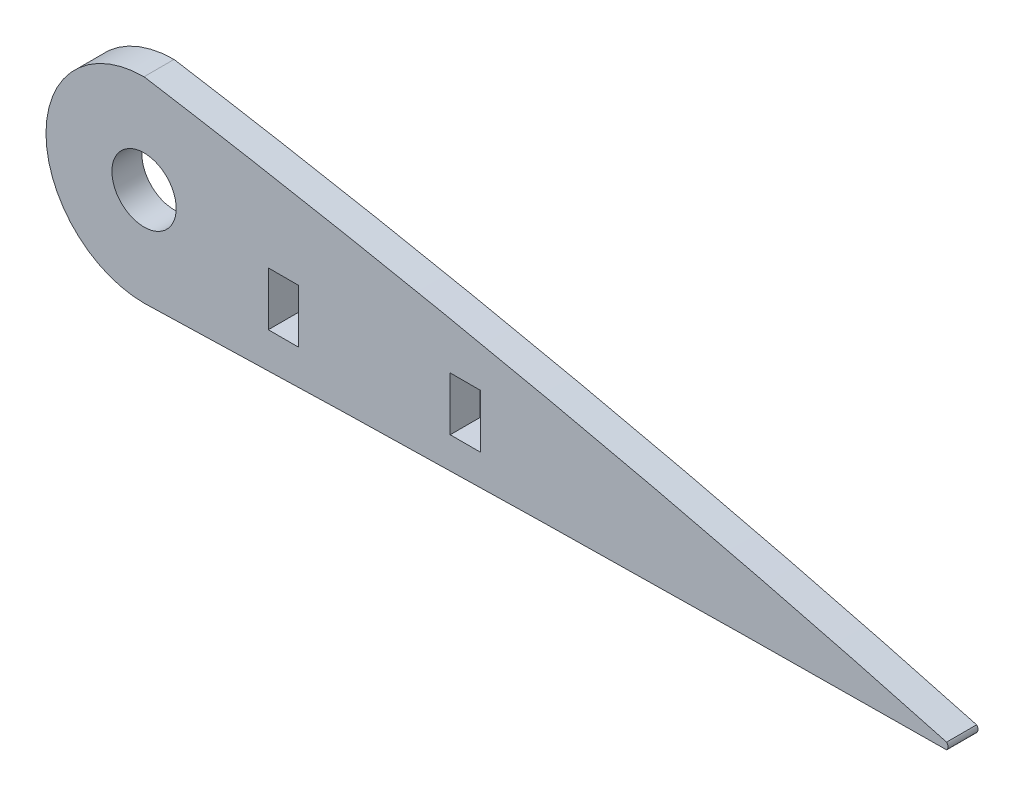
from build123d import *

# Parameters (mm, degrees)
SKETCH_1_R      = 3
SKETCH_1_W      = 2.8
SKETCH_1_H      = 5
SKETCH_1_W_2    = 2.85
EXTRUDE_1_DEPTH = 1.4


with BuildPart() as part:
    # Эскиз1 → Бобышка-Вытянуть1 (new, symmetric)
    with BuildSketch(Plane.XY):
        with BuildLine():
            ThreePointArc((175.091334091, 16.644787515), (168.620686799, 13.96455765), (165.940456932, 7.493910359))
            ThreePointArc((165.940456932, 7.493910359), (168.620686797, 1.023263065), (175.091334091, -1.656966802))
            add(Edge.make_bspline(
                [(175.091334091, -1.656966802), (177.330680613, -1.588466601), (181.854695323, -1.455127256), (188.663234462, -1.270383377), (195.516645168, -1.101112884), (202.369532894, -0.948617189), (211.49919029, -0.767742353), (220.603098666, -0.619939742), (229.617630172, -0.50292618), (236.087353854, -0.431514192), (241.980776913, -0.376520461), (246.558970011, -0.339535886), (249.120490965, -0.321271242), (250, -0.315)],
                knots=[0.704401069, 0.704401069, 0.704401069, 0.704401069, 0.730918775, 0.757971338, 0.785017763, 0.812061651, 0.839103366, 0.893099152, 0.919831065, 0.945809917, 0.969680601, 0.989589706, 1, 1, 1, 1], degree=3))
            ThreePointArc((250, -0.315), (250.130477272, 0), (250, 0.315))
            add(Edge.make_bspline(
                [(250, 0.315), (249.15566774, 0.545019818), (246.720175698, 1.208516243), (242.391332083, 2.358339053), (236.849761204, 3.787625364), (230.779918279, 5.298008837), (224.455917947, 6.812866028), (218.030543496, 8.291610632), (211.562405045, 9.719735057), (205.072411509, 11.092374932), (198.567970913, 12.407850726), (192.052369914, 13.665297924), (185.527619973, 14.864093303), (179.872800983, 15.850364437), (176.392239334, 16.431323122), (175.091334091, 16.644787515)],
                knots=[0, 0, 0, 0, 0.0101622, 0.029313053, 0.052011605, 0.076619468, 0.101948061, 0.127526132, 0.153184131, 0.178867888, 0.204557903, 0.230245712, 0.255925967, 0.281594302, 0.296903142, 0.296903142, 0.296903142, 0.296903142], degree=3))
        make_face()
        with Locations((175.091334091, 7.493910357)):
            Circle(SKETCH_1_R, mode=Mode.SUBTRACT)
        with Locations((188.091334091, 4.493910357)):
            Rectangle(SKETCH_1_W, SKETCH_1_H, mode=Mode.SUBTRACT)
        with Locations((205.091334091, 4.493910357)):
            Rectangle(SKETCH_1_W_2, SKETCH_1_H, mode=Mode.SUBTRACT)
    extrude(amount=EXTRUDE_1_DEPTH, both=True)


solid = part.part
